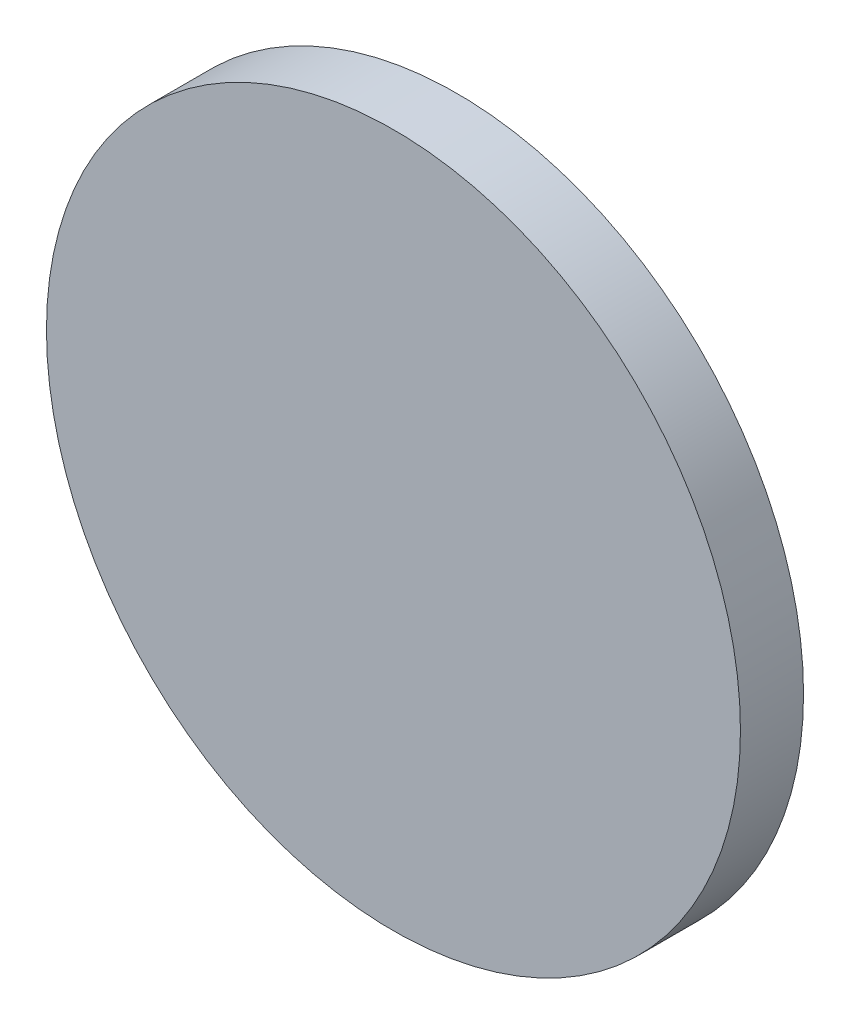
from build123d import *

# Parameters (mm, degrees)
ESQUISSE1_R          = 11
BASE_EXTRUSION_DEPTH = 2


with BuildPart() as part:
    # Esquisse1 → Base-Extrusion (new body)
    with BuildSketch(Plane.XY):
        Circle(ESQUISSE1_R)
    extrude(amount=BASE_EXTRUSION_DEPTH)


solid = part.part
